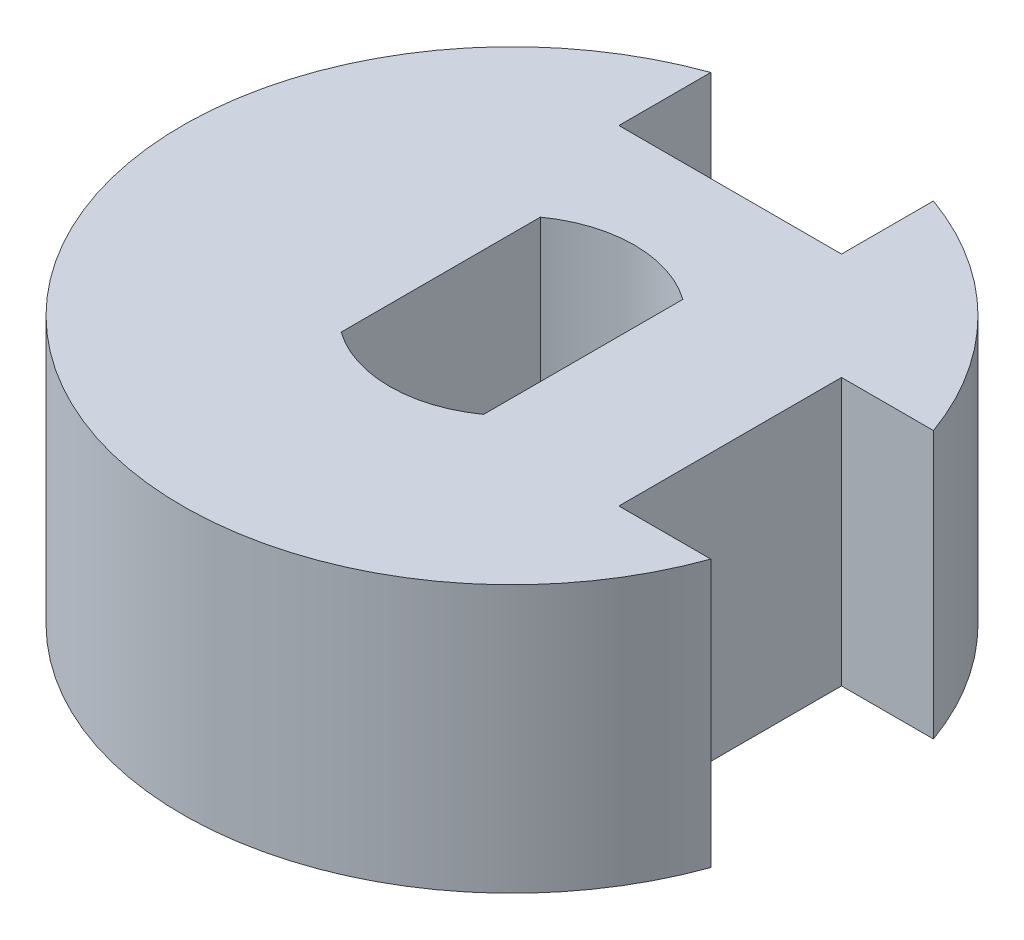
from build123d import *

# Parameters (mm, degrees)
BOSS_EXTRUDE1_DEPTH = 6


with BuildPart() as part:
    # Sketch1 → Boss-Extrude1 (new body)
    with BuildSketch(Plane(origin=(0, 0, 0), x_dir=(1, 0, 0), z_dir=(0, 1, 0))):
        with BuildLine():
            Line((4.9, -2.5), (4.9, 2.5))
            Line((4.9, 2.5), (6.96491206, 2.5))
            ThreePointArc((6.96491206, 2.5), (5.232590181, 5.232590181), (2.5, 6.96491206))
            Line((2.5, 6.96491206), (2.5, 4.9))
            Line((2.5, 4.9), (-2.5, 4.9))
            Line((-2.5, 4.9), (-2.5, 6.96491206))
            ThreePointArc((-2.5, 6.96491206), (-5.232590181, -5.232590181), (6.96491206, -2.5))
            Line((6.96491206, -2.5), (4.9, -2.5))
        make_face()
        with BuildLine():
            Line((-1.6, -2.236626925), (-1.6, 2.236626925))
            ThreePointArc((-1.6, 2.236626925), (0, 2.75), (1.6, 2.236626925))
            Line((1.6, 2.236626925), (1.6, -2.236626925))
            ThreePointArc((1.6, -2.236626925), (0, -2.75), (-1.6, -2.236626925))
        make_face(mode=Mode.SUBTRACT)
    extrude(amount=BOSS_EXTRUDE1_DEPTH)


solid = part.part
